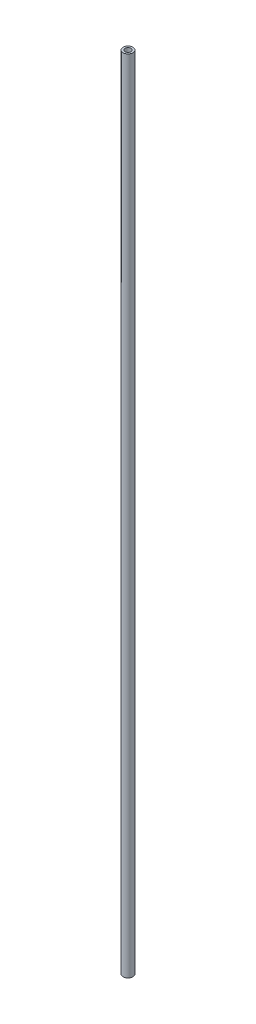
from build123d import *

# Parameters (mm, degrees)
SKETCH2_R           = 2.5
SKETCH2_R_2         = 1.5
BOSS_EXTRUDE1_DEPTH = 205


with BuildPart() as part:
    # Sketch2 → Boss-Extrude1 (new, symmetric)
    with BuildSketch(Plane(origin=(0, 0, 0), x_dir=(1, 0, 0), z_dir=(0, 1, 0))):
        with Locations(Location((0, 0, 0), (0, 0, 90))):
            Circle(SKETCH2_R)
        with Locations(Location((0, 0, 0), (0, 0, 90))):
            Circle(SKETCH2_R_2, mode=Mode.SUBTRACT)
    extrude(amount=BOSS_EXTRUDE1_DEPTH, both=True)


solid = part.part
